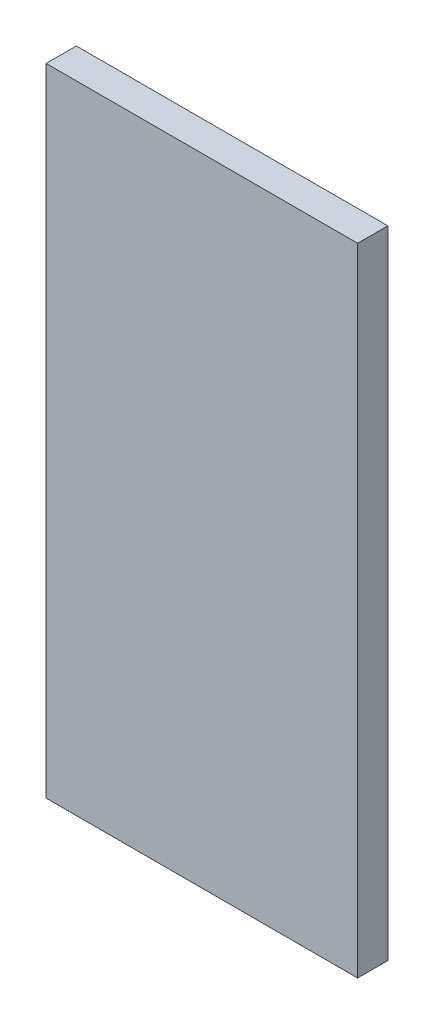
from build123d import *

# Parameters (mm, degrees)
SKETCH1_W           = 490
SKETCH1_H           = 1001
BOSS_EXTRUDE1_DEPTH = 47.5


with BuildPart() as part:
    # Sketch1 → Boss-Extrude1 (new body)
    with BuildSketch(Plane.XY):
        with Locations((245, 500.5)):
            Rectangle(SKETCH1_W, SKETCH1_H)
    extrude(amount=BOSS_EXTRUDE1_DEPTH)


solid = part.part
